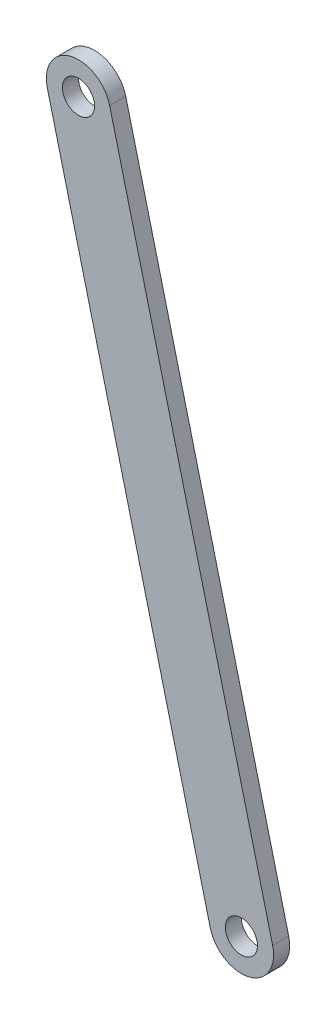
from build123d import *

# Parameters (mm, degrees)
BOSS_EXTRUDE1_START = 1.5875
SKETCH1_R           = 1.5875
BOSS_EXTRUDE1_DEPTH = 1.5875


with BuildPart() as part:
    # Sketch1 → Boss-Extrude1 (new body)
    with BuildSketch(Plane.XY.offset(BOSS_EXTRUDE1_START)):
        with BuildLine():
            Line((-56.152972974, -27.276267992), (-40.081568537, -90.980270687))
            ThreePointArc((-40.081568537, -90.980270687), (-42.383448285, -94.835474913), (-46.238652511, -92.533595165))
            Line((-46.238652511, -92.533595165), (-62.310056949, -28.82959247))
            ThreePointArc((-62.310056949, -28.82959247), (-60.0081772, -24.974388244), (-56.152972974, -27.276267992))
        make_face()
        with Locations((-43.160110524, -91.756932926)):
            Circle(SKETCH1_R, mode=Mode.SUBTRACT)
        with Locations((-59.231514961, -28.052930231)):
            Circle(SKETCH1_R, mode=Mode.SUBTRACT)
    extrude(amount=BOSS_EXTRUDE1_DEPTH)


solid = part.part
